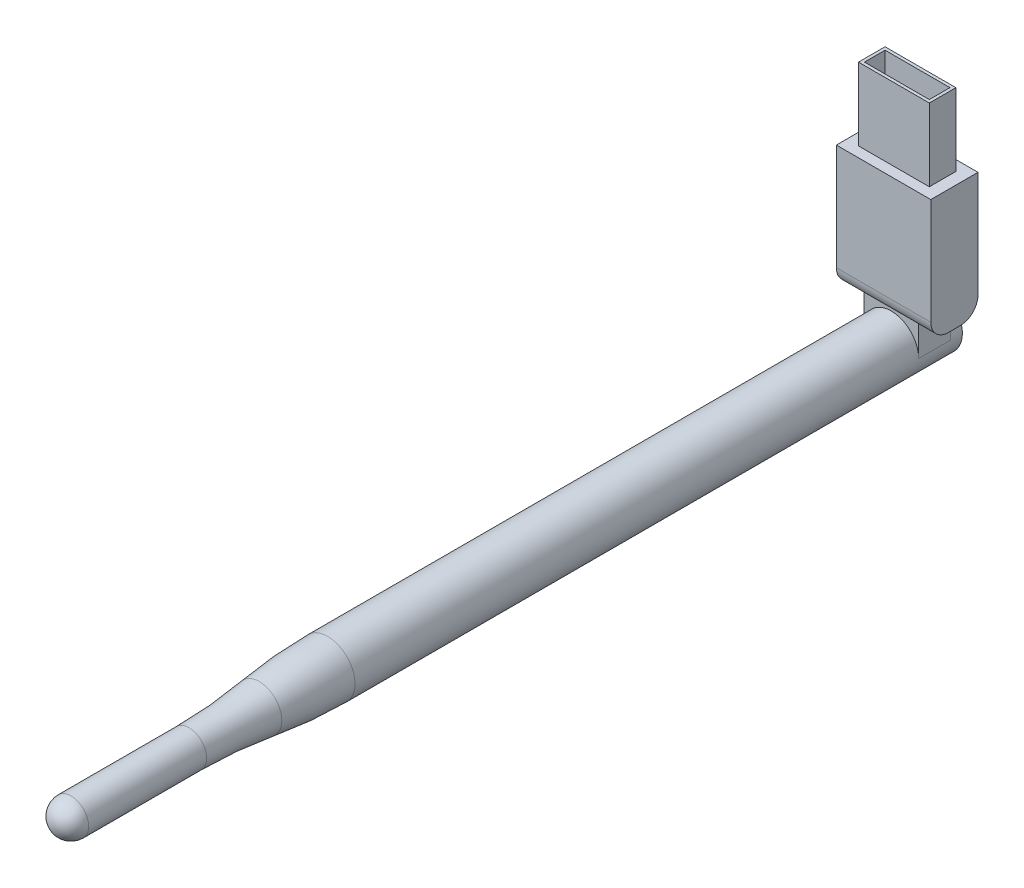
from build123d import *

# Parameters (mm, degrees)
RESSALTO_EXTRUS_O1_DEPTH      = 8
RESSALTO_EXTRUS_O2_DEPTH      = 12.3
CORTE_EXTRUS_O1_DEPTH         = 29.979993098687927
RESSALTO_EXTRUS_O3_DEPTH      = 9.3
RESSALTO_EXTRUS_O3_DEPTH_BACK = 12.3
CORTE_EXTRUS_O2_DEPTH         = 145.04110524430172
CORTE_EXTRUS_O5_START         = 3.75
ESBO_O10_W                    = 11
ESBO_O10_H                    = 3.4999999999999987
CORTE_EXTRUS_O5_DEPTH         = 149.21637788030614


with BuildPart() as part:
    # Esboço1 → Ressalto-extrusão1 (new body)
    with BuildSketch(Plane.XY):
        Polygon((-8, 10.499999999999998), (8, 10.499999999999998), (8.000000000000004, -10.500000000000002), (-8, -10.500000000000002), align=None)
    extrude(amount=RESSALTO_EXTRUS_O1_DEPTH)

    # Esboço2 → Ressalto-extrusão2 (add)
    with BuildSketch(Plane(origin=(0, 10.499999999999998, 0), x_dir=(1, 0, 0), z_dir=(0, 1, 0))):
        Polygon((-6.000000000000002, -1.750000000000001), (5.999999999999998, -1.750000000000001), (5.999999999999998, -6.25), (-6, -6.25), align=None)
    extrude(amount=RESSALTO_EXTRUS_O2_DEPTH)

    # Esboço3 → Corte-extrusão1 (cut, through all)
    with BuildSketch(Plane(origin=(8.000000000000002, 1.32e-15, 0), x_dir=(0, 0, -1), z_dir=(1, 1.7e-16, 0))):
        with BuildLine():
            Line((12.302112688752674, -8.041249801298202), (15.759799941349684, -18.709266127928004))
            Line((15.759799941349684, -18.709266127928004), (-12.82894273367674, -20.250050884769166))
            Line((-12.82894273367674, -20.250050884769166), (-17.748760130002903, -20.25005088476917))
            Line((-17.748760130002903, -20.25005088476917), (-21.504856301930886, -7.075521773543869))
            Line((-21.504856301930886, -7.075521773543869), (-8, -7.499999999999983))
            ThreePointArc((-8, -7.499999999999983), (-7.121320343559643, -9.621320343559647), (-4.999999999999979, -10.500000000000004))
            Line((-4.999999999999979, -10.500000000000004), (-3.0000000000000213, -10.500000000000004))
            ThreePointArc((-3.0000000000000213, -10.500000000000004), (-0.8786796564403576, -9.621320343559647), (0, -7.499999999999983))
            Line((0, -7.499999999999983), (12.302112688752674, -8.041249801298202))
        make_face()
    extrude(amount=-CORTE_EXTRUS_O1_DEPTH, mode=Mode.SUBTRACT)

    # Esboço4 → Ressalto-extrusão3 (add, two sides: drawn at the far end of the back side and taken through both)
    with BuildSketch(Plane.XZ.offset(10.500000000000002).offset(-RESSALTO_EXTRUS_O3_DEPTH_BACK)):
        Polygon((-4.6499999999999995, 6.700000000000003), (4.650000000000001, 6.700000000000004), (4.650000000000001, 1.3000000000000025), (-4.649999999999998, 1.3000000000000025), align=None)
    extrude(amount=RESSALTO_EXTRUS_O3_DEPTH + RESSALTO_EXTRUS_O3_DEPTH_BACK)

    # Esboço8 → Revolução1 (revolve)
    with BuildSketch(Plane(origin=(0, 0, 0), x_dir=(0, 0, -1), z_dir=(1, 0, 0)), mode=Mode.PRIVATE) as revolu_o1_sk:
        with BuildLine():
            Line((0.6999999999999975, -15.150000000000004), (-1.3000000000000025, -15.150000000000002))
            Line((-1.3000000000000025, -15.150000000000002), (-6.700000000000003, -15.150000000000004))
            Line((-6.700000000000003, -15.150000000000004), (-125.70000000000003, -15.150000000000018))
            Line((-125.70000000000003, -15.150000000000018), (-125.7, -18.150000000000013))
            ThreePointArc((-125.7, -18.150000000000006), (-119.7371767478927, -18.359131245703352), (-113.80365649100945, -18.985497252888337))
            ThreePointArc((-113.80365649100945, -18.985497252888337), (-108.01923466009754, -19.596123836980453), (-102.20624616421328, -19.80000000000001))
            Line((-102.20624616421328, -19.800000000000015), (-6.700000000000003, -19.800000000000004))
            Line((-6.700000000000003, -19.800000000000004), (0.6999999999999981, -19.800000000000004))
            Line((0.6999999999999981, -19.800000000000004), (0.6999999999999975, -15.150000000000004))
        make_face()
        with BuildLine():
            Line((-125.7, -18.150000000000013), (-125.70000000000003, -15.150000000000018))
            Line((-125.70000000000003, -15.150000000000018), (-148.7, -15.15000000000002))
            ThreePointArc((-148.7, -15.15000000000002), (-147.82132034355962, -17.271320343559655), (-145.7, -18.15000000000001))
            Line((-145.7, -18.150000000000013), (-125.7, -18.150000000000013))
        make_face()
    revolve(revolu_o1_sk.sketch.rotate(Axis((0, -15.150000000000004, 6.700000000000003), (0, -1.1e-16, 1)), 180), axis=Axis((0, -15.150000000000004, 6.700000000000003), (0, -1.1e-16, 1)))

    # Esboço9 → Corte-extrusão2 (cut, through all)
    with BuildSketch(Plane.XY.offset(6.700000000000003)):
        with BuildLine():
            ThreePointArc((4.650000000000001, -15.150000000000004), (3.2880465325174466, -18.43804653251745), (6.2e-16, -19.800000000000004))
            Line((6.2e-16, -19.800000000000004), (4.650000000000002, -19.800000000000004))
            Line((4.650000000000002, -19.800000000000004), (4.650000000000002, -15.150000000000004))
        make_face()
        with BuildLine():
            Line((-4.649999999999999, -19.800000000000004), (8.9e-16, -19.800000000000004))
            ThreePointArc((4.1e-16, -19.800000000000004), (-3.2880465325174453, -18.43804653251745), (-4.649999999999998, -15.150000000000004))
            Line((-4.649999999999999, -15.150000000000004), (-4.649999999999999, -19.800000000000004))
        make_face()
    extrude(amount=-CORTE_EXTRUS_O2_DEPTH, mode=Mode.SUBTRACT)

    # Esboço10 → Corte-extrusão5 (cut, through all)
    with BuildSketch(Plane(origin=(0, 10.499999999999998, 0), x_dir=(1, 0, 0), z_dir=(0, 1, 0)).offset(CORTE_EXTRUS_O5_START)):
        with Locations((-1.78e-15, -4.000000000000001)):
            Rectangle(ESBO_O10_W, ESBO_O10_H)
    extrude(amount=CORTE_EXTRUS_O5_DEPTH, mode=Mode.SUBTRACT)


solid = part.part
